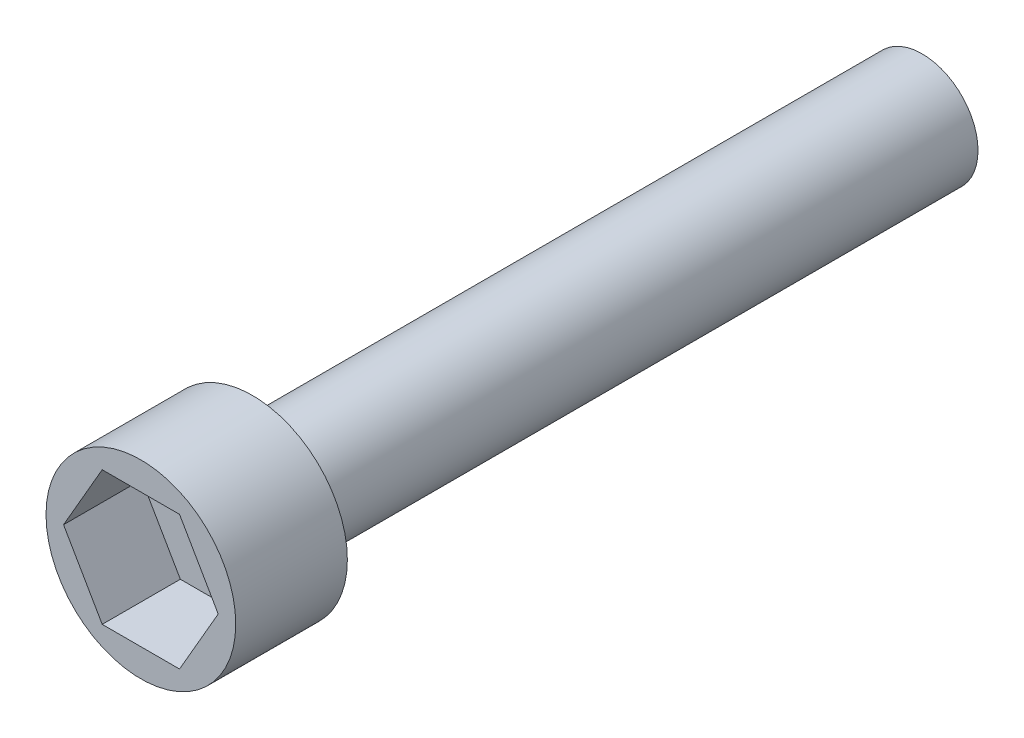
from build123d import *

# Parameters (mm, degrees)
ESQUISSE1_R             = 2.5
BOSS_EXTRU_1_DEPTH      = 30
ESQUISSE2_R             = 4.25
BOSS_EXTRU_2_DEPTH      = 5
ENL_V_MAT_EXTRU_1_DEPTH = 3.5


with BuildPart() as part:
    # Esquisse1 → Boss.-Extru.1 (new body)
    with BuildSketch(Plane.XY):
        Circle(ESQUISSE1_R)
    extrude(amount=BOSS_EXTRU_1_DEPTH)

    # Esquisse2 → Boss.-Extru.2 (add)
    with BuildSketch(Plane.XY.offset(30)):
        Circle(ESQUISSE2_R)
    extrude(amount=BOSS_EXTRU_2_DEPTH)

    # Esquisse3 → Enlèv. mat.-Extru.1 (cut)
    with BuildSketch(Plane.XY.offset(35)):
        Polygon((3.464101615, 0), (1.732050808, 3), (-1.732050808, 3), (-3.464101615, 0), (-1.732050808, -3), (1.732050808, -3), align=None)
    extrude(amount=-ENL_V_MAT_EXTRU_1_DEPTH, mode=Mode.SUBTRACT)


solid = part.part
